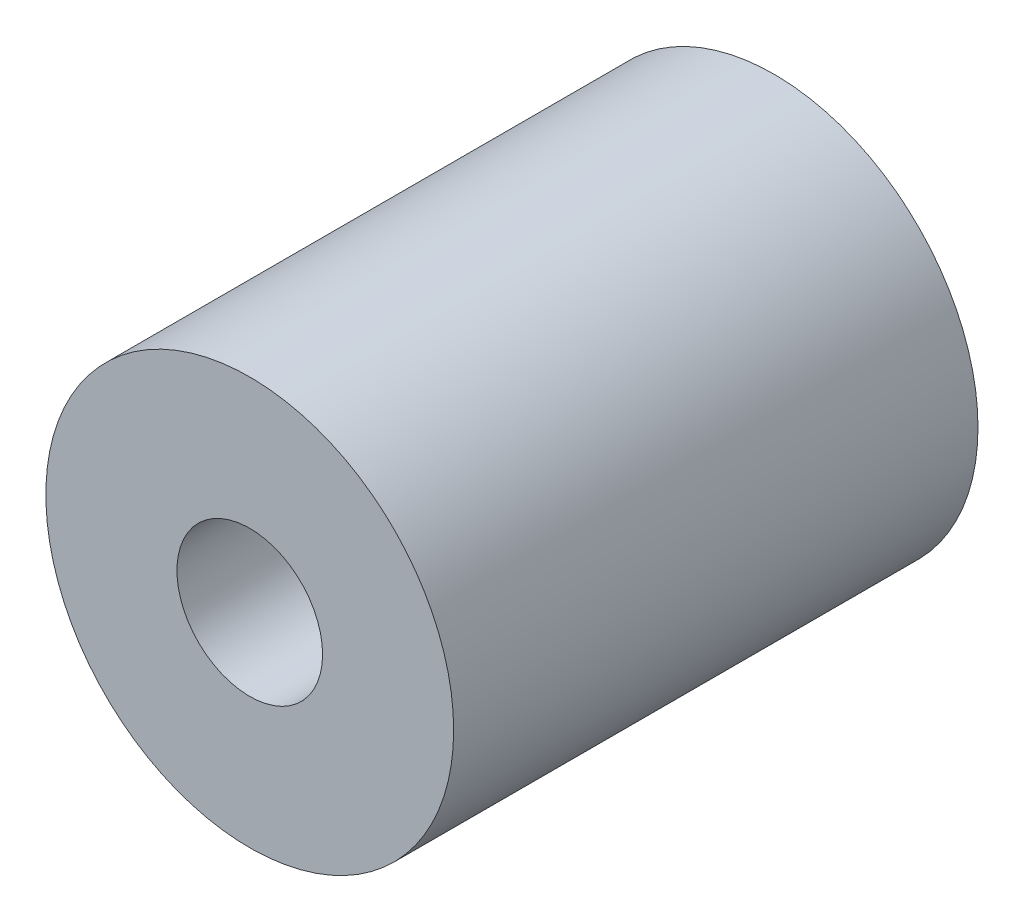
from build123d import *

# Parameters (mm, degrees)
SKETCH_1_R      = 7
EXTRUDE_1_DEPTH = 8
SKETCH_2_R      = 7
SKETCH_2_R_2    = 2.5
EXTRUDE_2_DEPTH = 10


with BuildPart() as part:
    # Эскиз1 → Бобышка-Вытянуть1 (new body)
    with BuildSketch(Plane.XY):
        Circle(SKETCH_1_R)
        Polygon((2.280533563, -3.95), (4.561067127, 0), (2.280533563, 3.95), (-2.280533563, 3.95), (-4.561067127, 0), (-2.280533563, -3.95), align=None, mode=Mode.SUBTRACT)
    extrude(amount=EXTRUDE_1_DEPTH)

    # Эскиз2 → Бобышка-Вытянуть2 (add)
    with BuildSketch(Plane.XY.offset(8)):
        Circle(SKETCH_2_R)
        Circle(SKETCH_2_R_2, mode=Mode.SUBTRACT)
    extrude(amount=EXTRUDE_2_DEPTH)


solid = part.part
